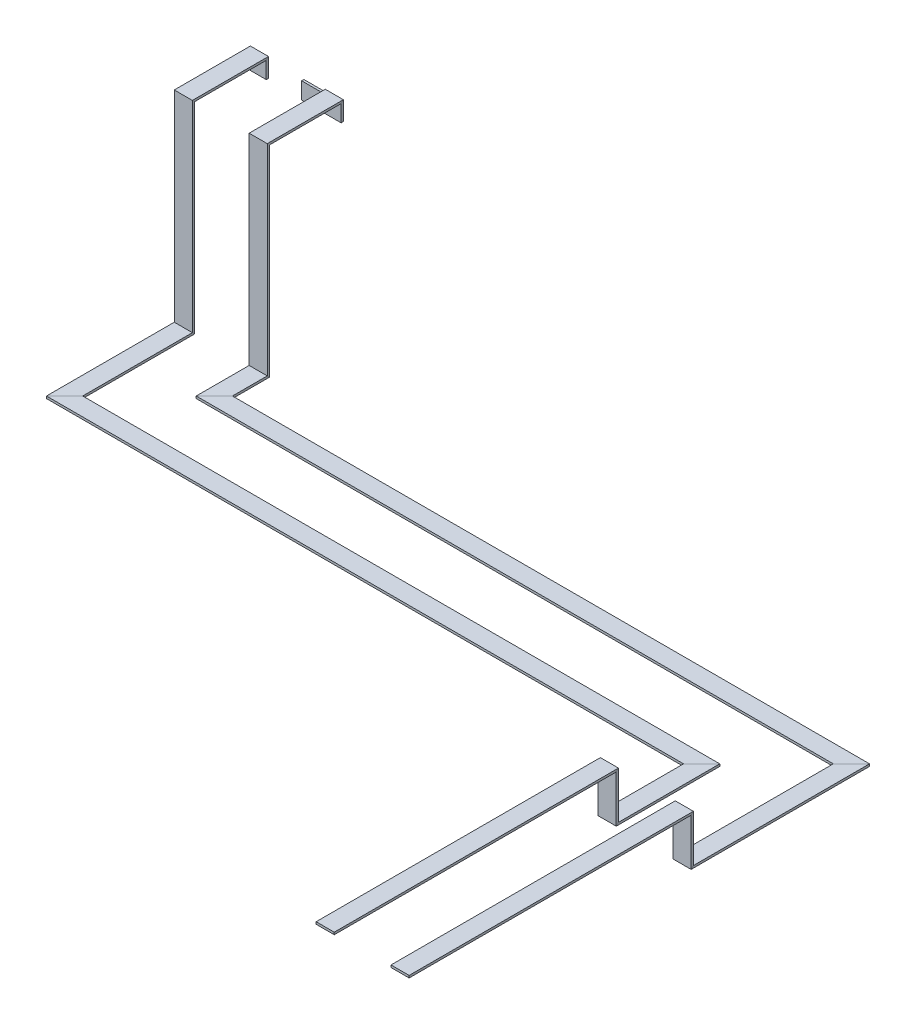
from build123d import *

# Parameters (mm, degrees)
CROQUIS2_W              = 50.8
CROQUIS2_H              = 6.31
CROQUIS3_W              = 50.8
CROQUIS3_H              = 6.31
CROQUIS4_W              = 60
CROQUIS4_H              = 53.155
SALIENTE_EXTRUIR1_DEPTH = 6.31
CROQUIS5_W              = 60
CROQUIS5_H              = 6.31
CORTAR_EXTRUIR1_DEPTH   = 6.31


with BuildPart() as part:
    # Barrer1: sweep along a curve in space
    with BuildLine() as barrer1_path:
        Line((0, 0, 0), (0, -567.24, 0))
        Line((0, -567.24, 0), (0, -567.24, 336.2))
        Line((0, -567.24, 336.2), (1786.7, -567.24, 336.2))
        Line((1786.7, -567.24, 336.2), (1786.7, -567.24, 598))
        Line((1786.7, -567.24, 598), (1786.7, -435.47278313, 598))
        Line((1786.7, -435.47278313, 598), (1786.7, -435.47278313, 1392.002933))
    # Croquis2 → Barrer1 (sweep)
    with BuildSketch(Plane(origin=(0, 0, 0), x_dir=(1, 0, 0), z_dir=(0, 1, 0))):
        Rectangle(CROQUIS2_W, CROQUIS2_H)
        with Locations((210, 0)):
            Rectangle(CROQUIS2_W, CROQUIS2_H)
    sweep(path=barrer1_path.line, transition=Transition.RIGHT)

    # Barrer4: sweep along a curve in space
    with BuildLine() as barrer4_path:
        Line((-0.201028049, -3.155, -3.155), (-0.201028049, -3.155, -207.155))
        Line((-0.201028049, -3.155, -207.155), (-0.201028049, -53.155, -207.155))
    # Croquis3 → Barrer4 (sweep)
    with BuildSketch(Plane(origin=(0, 0, -3.155), x_dir=(-1, 0, 0), z_dir=(0, 0, -1))):
        with Locations((-210, -3.155)):
            Rectangle(CROQUIS3_W, CROQUIS3_H)
        with Locations((0, -3.155)):
            Rectangle(CROQUIS3_W, CROQUIS3_H)
    sweep(path=barrer4_path.line, transition=Transition.RIGHT)

    # Croquis4 → Saliente-Extruir1 (add)
    with BuildSketch(Plane(origin=(0, 0, -210.31), x_dir=(-1, 0, 0), z_dir=(0, 0, -1))):
        with Locations((-154.6, -26.5775)):
            Rectangle(CROQUIS4_W, CROQUIS4_H)
    extrude(amount=-SALIENTE_EXTRUIR1_DEPTH)

    # Croquis5 → Cortar-Extruir1 (cut)
    with BuildSketch(Plane.XY.offset(-204)):
        with Locations((154.6, -3.155)):
            Rectangle(CROQUIS5_W, CROQUIS5_H)
    extrude(amount=-CORTAR_EXTRUIR1_DEPTH, mode=Mode.SUBTRACT)


solid = part.part
